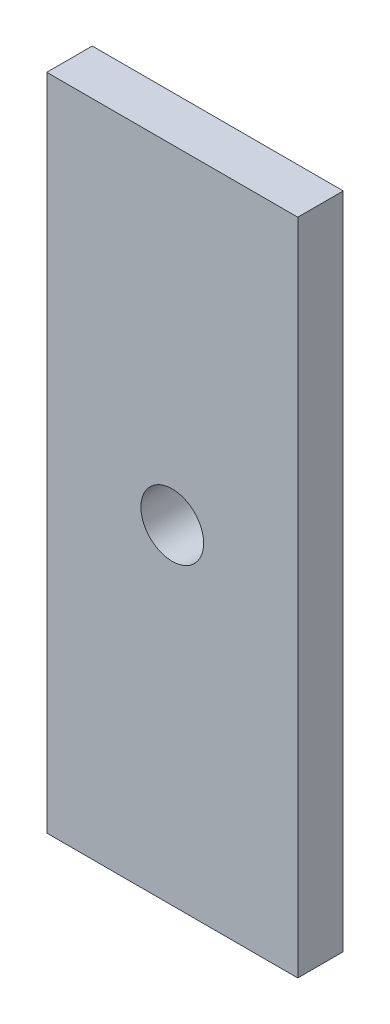
from build123d import *

# Parameters (mm, degrees)
SKETCH_1_W      = 32
SKETCH_1_H      = 84
SKETCH_1_R      = 4
EXTRUDE_1_DEPTH = 5.8


with BuildPart() as part:
    # Эскиз1 → Бобышка-Вытянуть1 (new body)
    with BuildSketch(Plane.XY):
        with Locations((16, 42)):
            Rectangle(SKETCH_1_W, SKETCH_1_H)
        with Locations((16, 42)):
            Circle(SKETCH_1_R, mode=Mode.SUBTRACT)
    extrude(amount=EXTRUDE_1_DEPTH)


solid = part.part
